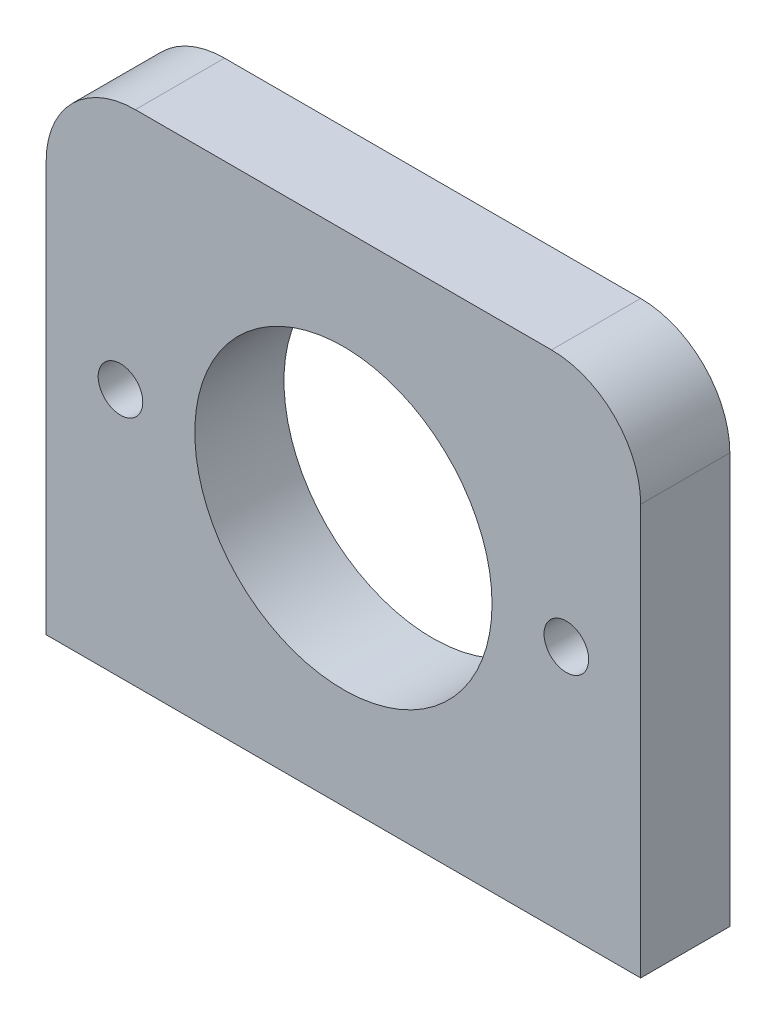
from build123d import *

# Parameters (mm, degrees)
SKETCH1_R           = 25
SKETCH1_R_2         = 3.75
BOSS_EXTRUDE1_DEPTH = 15


with BuildPart() as part:
    # Sketch1 → Boss-Extrude1 (new body)
    with BuildSketch(Plane.XY):
        with BuildLine():
            Line((-50, -42), (50, -42))
            Line((50, -42), (50, 27))
            ThreePointArc((50, 27), (45.606601718, 37.606601718), (35, 42))
            Line((35, 42), (-35, 42))
            ThreePointArc((-35, 42), (-45.606601718, 37.606601718), (-50, 27))
            Line((-50, 27), (-50, -42))
        make_face()
        Circle(SKETCH1_R, mode=Mode.SUBTRACT)
        with Locations((-37.5, 0)):
            Circle(SKETCH1_R_2, mode=Mode.SUBTRACT)
        with Locations(Location((37.5, 0, 0), (0, 0, 180))):
            Circle(SKETCH1_R_2, mode=Mode.SUBTRACT)
    extrude(amount=BOSS_EXTRUDE1_DEPTH)


solid = part.part
